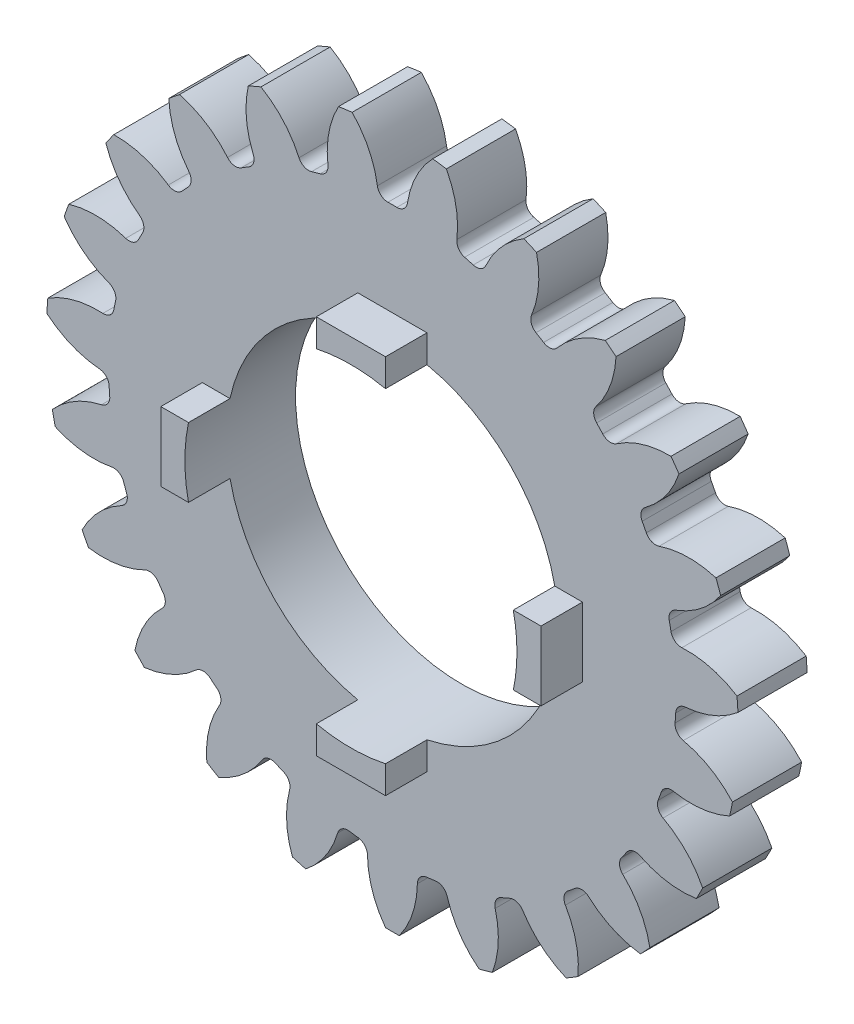
from build123d import *

# Parameters (mm, degrees)
SKETCH1_R                = 25
BOSS_EXTRUDE1_DEPTH      = 5
CUT_EXTRUDE1_DEPTH       = 10
FILLET2_R                = 0.76
CIRPATTERN2_COUNT        = 23
FILLET2_OF_CIRPATTERN2_R = 0.76
SKETCH2_R                = 12
CUT_EXTRUDE2_DEPTH       = 5
BOSS_EXTRUDE2_START      = 3
BOSS_EXTRUDE2_DEPTH      = 3


with BuildPart() as part:
    # Sketch1 → Boss-Extrude1 (new body)
    with BuildSketch(Plane.XY):
        Circle(SKETCH1_R)
    extrude(amount=-BOSS_EXTRUDE1_DEPTH)

    # Sketch1<4> → Cut-Extrude1 (cut)
    with BuildSketch(Plane.XY):
        with BuildLine():
            ThreePointArc((-1.019131614, 20.474651908), (0, 20.5), (1.019131614, 20.474651908))
            ThreePointArc((1.019131614, 20.474651908), (1.567936083, 22.824084553), (2.908167189, 24.830275141))
            ThreePointArc((2.908167189, 24.830275141), (0, 25), (-2.908167189, 24.830275141))
            ThreePointArc((-2.908167189, 24.830275141), (-1.567936083, 22.824084553), (-1.019131614, 20.474651908))
        make_face()
    cut_extrude1 = extrude(amount=-CUT_EXTRUDE1_DEPTH, mode=Mode.SUBTRACT)

    # Fillet2
    fillet2_edges = [part.edges().sort_by_distance(p)[0] for p in [
        (1.019131614, 20.474651908, -2.5),
        (-1.019131614, 20.474651908, -2.5),
    ]]
    fillet(fillet2_edges, radius=FILLET2_R)

    # CirPattern2: Cut-Extrude1 ×23 about axis
    cirpattern2_axis = Axis((0, 0, 0), (0, 0, 1))
    for i in range(1, CIRPATTERN2_COUNT):
        add(cut_extrude1.rotate(cirpattern2_axis, i * 360 / CIRPATTERN2_COUNT), mode=Mode.SUBTRACT)

    # Fillet2 of CirPattern2
    fillet2_of_cirpattern2_edges = [part.edges().sort_by_distance(p)[0] for p in [
        (-4.542655526, 19.990354693, -2.5),
        (-6.505334424, 19.440437856, -2.5),
        (-9.767534687, 18.023464321, -2.5),
        (-11.509066341, 16.964415462, -2.5),
        (-14.268000484, 14.719856052, -2.5),
        (-15.659223457, 13.23021998, -2.5),
        (-17.710273957, 10.324543398, -2.5),
        (-18.648007605, 8.514799607, -2.5),
        (-19.839057429, 5.163506592, -2.5),
        (-20.253754339, 3.167875499, -2.5),
        (-20.49646877, -0.380483876, -2.5),
        (-20.357372768, -2.413995442, -2.5),
        (-19.633750786, -5.896255596, -2.5),
        (-18.951177987, -7.816831384, -2.5),
        (-17.314887326, -10.974729012, -2.5),
        (-16.139461031, -12.639928703, -2.5),
        (-13.711857883, -15.239256983, -2.5),
        (-12.130754084, -16.525580333, -2.5),
        (-9.091882668, -18.373558979, -2.5),
        (-7.2223646, -19.18560527, -2.5),
        (-3.797604109, -20.145178158, -2.5),
        (-1.778325375, -20.422721632, -2.5),
        (1.778325375, -20.422721632, -2.5),
        (3.797604109, -20.145178158, -2.5),
        (7.2223646, -19.18560527, -2.5),
        (9.091882668, -18.373558979, -2.5),
        (12.130754084, -16.525580333, -2.5),
        (13.711857883, -15.239256983, -2.5),
        (16.139461031, -12.639928703, -2.5),
        (17.314887326, -10.974729012, -2.5),
        (18.951177987, -7.816831384, -2.5),
        (19.633750786, -5.896255596, -2.5),
        (20.357372768, -2.413995442, -2.5),
        (20.49646877, -0.380483876, -2.5),
        (20.253754339, 3.167875499, -2.5),
        (19.839057429, 5.163506592, -2.5),
        (18.648007605, 8.514799607, -2.5),
        (17.710273957, 10.324543398, -2.5),
        (15.659223457, 13.23021998, -2.5),
        (14.268000484, 14.719856052, -2.5),
        (11.509066341, 16.964415462, -2.5),
        (9.767534687, 18.023464321, -2.5),
        (6.505334424, 19.440437856, -2.5),
        (4.542655526, 19.990354693, -2.5),
    ]]
    fillet(fillet2_of_cirpattern2_edges, radius=FILLET2_OF_CIRPATTERN2_R)

    # Sketch2 → Cut-Extrude2 (cut)
    with BuildSketch(Plane.XY):
        Circle(SKETCH2_R)
    extrude(amount=-CUT_EXTRUDE2_DEPTH, mode=Mode.SUBTRACT)

    # Sketch3 → Boss-Extrude2 (add)
    with BuildSketch(Plane.XY.offset(BOSS_EXTRUDE2_START)):
        with BuildLine():
            Line((-2.5, 11.736694594), (-2.5, 13.736694594))
            Line((-2.5, 13.736694594), (2.5, 13.736694594))
            Line((2.5, 13.736694594), (2.5, 11.736694594))
            ThreePointArc((2.5, 11.736694594), (0, 12), (-2.5, 11.736694594))
        make_face()
        with BuildLine():
            Line((13.736694594, -2.5), (11.736694594, -2.5))
            ThreePointArc((11.736694594, -2.5), (12, 0), (11.736694594, 2.5))
            Line((11.736694594, 2.5), (13.736694594, 2.5))
            Line((13.736694594, 2.5), (13.736694594, -2.5))
        make_face()
        with BuildLine():
            Line((-2.5, -13.736694594), (-2.5, -11.736694594))
            ThreePointArc((-2.5, -11.736694594), (0, -12), (2.5, -11.736694594))
            Line((2.5, -11.736694594), (2.5, -13.736694594))
            Line((2.5, -13.736694594), (-2.5, -13.736694594))
        make_face()
        with BuildLine():
            Line((-13.736694594, 2.5), (-11.736694594, 2.5))
            ThreePointArc((-11.736694594, 2.5), (-12, 0), (-11.736694594, -2.5))
            Line((-11.736694594, -2.5), (-13.736694594, -2.5))
            Line((-13.736694594, -2.5), (-13.736694594, 2.5))
        make_face()
    extrude(amount=-BOSS_EXTRUDE2_DEPTH)


solid = part.part
